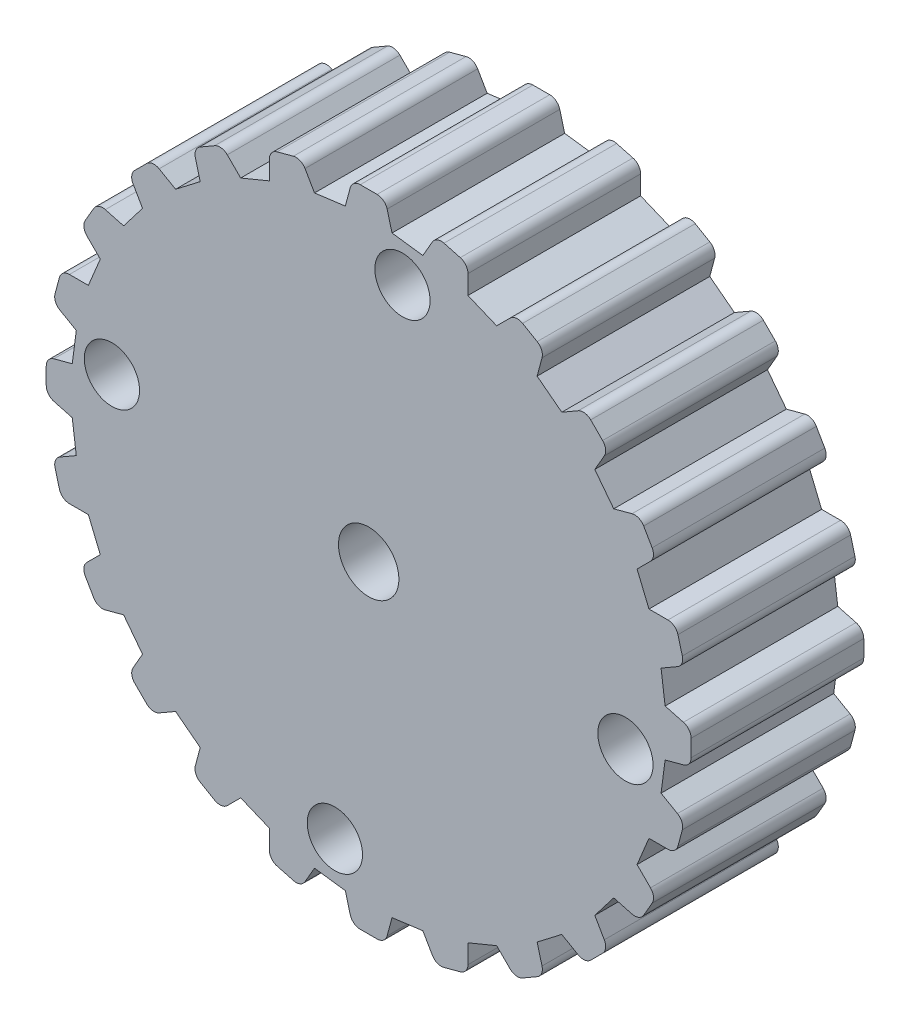
from build123d import *

# Parameters (mm, degrees)
BOSS_EXTRU_1_DEPTH      = 10
ESQUISSE2_R             = 1.6
ESQUISSE2_R_2           = 1.75
ENL_V_MAT_EXTRU_1_DEPTH = 29.241415019


with BuildPart() as part:
    # Esquisse1 → Boss.-Extru.1 (new body)
    with BuildSketch(Plane.XY):
        with BuildLine():
            Line((0.488939824, 18.675887158), (0, 18.675887158))
            Line((0, 18.675887158), (-0.488939824, 18.675887158))
            ThreePointArc((-0.488939824, 18.675887158), (-0.854196682, 18.551899162), (-1.06849532, 18.231178585))
            Line((-1.06849532, 18.231178585), (-1.352750131, 17.170325189))
            Line((-1.352750131, 17.170325189), (-3.137350881, 16.935378043))
            Line((-3.137350881, 16.935378043), (-3.686489007, 17.886513177))
            ThreePointArc((-3.686489007, 17.886513177), (-3.97649419, 18.140840897), (-4.361395677, 18.166068673))
            Line((-4.361395677, 18.166068673), (-4.833675281, 18.039521734))
            Line((-4.833675281, 18.039521734), (-5.305954884, 17.912974796))
            ThreePointArc((-5.305954884, 17.912974796), (-5.626675462, 17.698676158), (-5.750663457, 17.3334193))
            Line((-5.750663457, 17.3334193), (-5.750663457, 16.235143048))
            Line((-5.750663457, 16.235143048), (-7.413646616, 15.54631287))
            Line((-7.413646616, 15.54631287), (-8.190245201, 16.322911455))
            ThreePointArc((-8.190245201, 16.322911455), (-8.536193555, 16.493514304), (-8.91450927, 16.418262629))
            Line((-8.91450927, 16.418262629), (-9.337943579, 16.173792717))
            Line((-9.337943579, 16.173792717), (-9.761377888, 15.929322805))
            ThreePointArc((-9.761377888, 15.929322805), (-10.015705607, 15.639317622), (-10.040933383, 15.254416135))
            Line((-10.040933383, 15.254416135), (-9.756678573, 14.193562739))
            Line((-9.756678573, 14.193562739), (-11.184714585, 13.097792167))
            Line((-11.184714585, 13.097792167), (-12.13584972, 13.646930293))
            ThreePointArc((-12.13584972, 13.646930293), (-12.514165435, 13.722181967), (-12.860113788, 13.551579119))
            Line((-12.860113788, 13.551579119), (-13.205846454, 13.205846454))
            Line((-13.205846454, 13.205846454), (-13.551579119, 12.860113788))
            ThreePointArc((-13.551579119, 12.860113788), (-13.722181967, 12.514165435), (-13.646930293, 12.13584972))
            Line((-13.646930293, 12.13584972), (-13.097792167, 11.184714585))
            Line((-13.097792167, 11.184714585), (-14.193562739, 9.756678573))
            Line((-14.193562739, 9.756678573), (-15.254416135, 10.040933383))
            ThreePointArc((-15.254416135, 10.040933383), (-15.639317622, 10.015705607), (-15.929322805, 9.761377888))
            Line((-15.929322805, 9.761377888), (-16.173792717, 9.337943579))
            Line((-16.173792717, 9.337943579), (-16.418262629, 8.91450927))
            ThreePointArc((-16.418262629, 8.91450927), (-16.493514304, 8.536193555), (-16.322911455, 8.190245201))
            Line((-16.322911455, 8.190245201), (-15.54631287, 7.413646616))
            Line((-15.54631287, 7.413646616), (-16.235143048, 5.750663457))
            Line((-16.235143048, 5.750663457), (-17.3334193, 5.750663457))
            ThreePointArc((-17.3334193, 5.750663457), (-17.698676158, 5.626675462), (-17.912974796, 5.305954884))
            Line((-17.912974796, 5.305954884), (-18.039521734, 4.833675281))
            Line((-18.039521734, 4.833675281), (-18.166068673, 4.361395677))
            ThreePointArc((-18.166068673, 4.361395677), (-18.140840897, 3.97649419), (-17.886513177, 3.686489007))
            Line((-17.886513177, 3.686489007), (-16.935378043, 3.137350881))
            Line((-16.935378043, 3.137350881), (-17.170325189, 1.352750131))
            Line((-17.170325189, 1.352750131), (-18.231178585, 1.06849532))
            ThreePointArc((-18.231178585, 1.06849532), (-18.551899162, 0.854196682), (-18.675887158, 0.488939824))
            Line((-18.675887158, 0.488939824), (-18.675887158, 0))
            Line((-18.675887158, 0), (-18.675887158, -0.488939824))
            ThreePointArc((-18.675887158, -0.488939824), (-18.551899162, -0.854196682), (-18.231178585, -1.06849532))
            Line((-18.231178585, -1.06849532), (-17.170325189, -1.352750131))
            Line((-17.170325189, -1.352750131), (-16.935378043, -3.137350881))
            Line((-16.935378043, -3.137350881), (-17.886513177, -3.686489007))
            ThreePointArc((-17.886513177, -3.686489007), (-18.140840897, -3.97649419), (-18.166068673, -4.361395677))
            Line((-18.166068673, -4.361395677), (-18.039521734, -4.833675281))
            Line((-18.039521734, -4.833675281), (-17.912974796, -5.305954884))
            ThreePointArc((-17.912974796, -5.305954884), (-17.698676158, -5.626675462), (-17.3334193, -5.750663457))
            Line((-17.3334193, -5.750663457), (-16.235143048, -5.750663457))
            Line((-16.235143048, -5.750663457), (-15.54631287, -7.413646616))
            Line((-15.54631287, -7.413646616), (-16.322911455, -8.190245201))
            ThreePointArc((-16.322911455, -8.190245201), (-16.493514304, -8.536193555), (-16.418262629, -8.91450927))
            Line((-16.418262629, -8.91450927), (-16.173792717, -9.337943579))
            Line((-16.173792717, -9.337943579), (-15.929322805, -9.761377888))
            ThreePointArc((-15.929322805, -9.761377888), (-15.639317622, -10.015705607), (-15.254416135, -10.040933383))
            Line((-15.254416135, -10.040933383), (-14.193562739, -9.756678573))
            Line((-14.193562739, -9.756678573), (-13.097792167, -11.184714585))
            Line((-13.097792167, -11.184714585), (-13.646930293, -12.13584972))
            ThreePointArc((-13.646930293, -12.13584972), (-13.722181967, -12.514165435), (-13.551579119, -12.860113788))
            Line((-13.551579119, -12.860113788), (-13.205846454, -13.205846454))
            Line((-13.205846454, -13.205846454), (-12.860113788, -13.551579119))
            ThreePointArc((-12.860113788, -13.551579119), (-12.514165435, -13.722181967), (-12.13584972, -13.646930293))
            Line((-12.13584972, -13.646930293), (-11.184714585, -13.097792167))
            Line((-11.184714585, -13.097792167), (-9.756678573, -14.193562739))
            Line((-9.756678573, -14.193562739), (-10.040933383, -15.254416135))
            ThreePointArc((-10.040933383, -15.254416135), (-10.015705607, -15.639317622), (-9.761377888, -15.929322805))
            Line((-9.761377888, -15.929322805), (-9.337943579, -16.173792717))
            Line((-9.337943579, -16.173792717), (-8.91450927, -16.418262629))
            ThreePointArc((-8.91450927, -16.418262629), (-8.536193555, -16.493514304), (-8.190245201, -16.322911455))
            Line((-8.190245201, -16.322911455), (-7.413646616, -15.54631287))
            Line((-7.413646616, -15.54631287), (-5.750663457, -16.235143048))
            Line((-5.750663457, -16.235143048), (-5.750663457, -17.3334193))
            ThreePointArc((-5.750663457, -17.3334193), (-5.626675462, -17.698676158), (-5.305954884, -17.912974796))
            Line((-5.305954884, -17.912974796), (-4.833675281, -18.039521734))
            Line((-4.833675281, -18.039521734), (-4.361395677, -18.166068673))
            ThreePointArc((-4.361395677, -18.166068673), (-3.97649419, -18.140840897), (-3.686489007, -17.886513177))
            Line((-3.686489007, -17.886513177), (-3.137350881, -16.935378043))
            Line((-3.137350881, -16.935378043), (-1.352750131, -17.170325189))
            Line((-1.352750131, -17.170325189), (-1.06849532, -18.231178585))
            ThreePointArc((-1.06849532, -18.231178585), (-0.854196682, -18.551899162), (-0.488939824, -18.675887158))
            Line((-0.488939824, -18.675887158), (0, -18.675887158))
            Line((0, -18.675887158), (0.488939824, -18.675887158))
            ThreePointArc((0.488939824, -18.675887158), (0.854196682, -18.551899162), (1.06849532, -18.231178585))
            Line((1.06849532, -18.231178585), (1.352750131, -17.170325189))
            Line((1.352750131, -17.170325189), (3.137350881, -16.935378043))
            Line((3.137350881, -16.935378043), (3.686489007, -17.886513177))
            ThreePointArc((3.686489007, -17.886513177), (3.97649419, -18.140840897), (4.361395677, -18.166068673))
            Line((4.361395677, -18.166068673), (4.833675281, -18.039521734))
            Line((4.833675281, -18.039521734), (5.305954884, -17.912974796))
            ThreePointArc((5.305954884, -17.912974796), (5.626675462, -17.698676158), (5.750663457, -17.3334193))
            Line((5.750663457, -17.3334193), (5.750663457, -16.235143048))
            Line((5.750663457, -16.235143048), (7.413646616, -15.54631287))
            Line((7.413646616, -15.54631287), (8.190245201, -16.322911455))
            ThreePointArc((8.190245201, -16.322911455), (8.536193555, -16.493514304), (8.91450927, -16.418262629))
            Line((8.91450927, -16.418262629), (9.337943579, -16.173792717))
            Line((9.337943579, -16.173792717), (9.761377888, -15.929322805))
            ThreePointArc((9.761377888, -15.929322805), (10.015705607, -15.639317622), (10.040933383, -15.254416135))
            Line((10.040933383, -15.254416135), (9.756678573, -14.193562739))
            Line((9.756678573, -14.193562739), (11.184714585, -13.097792167))
            Line((11.184714585, -13.097792167), (12.13584972, -13.646930293))
            ThreePointArc((12.13584972, -13.646930293), (12.514165435, -13.722181967), (12.860113788, -13.551579119))
            Line((12.860113788, -13.551579119), (13.205846454, -13.205846454))
            Line((13.205846454, -13.205846454), (13.551579119, -12.860113788))
            ThreePointArc((13.551579119, -12.860113788), (13.722181967, -12.514165435), (13.646930293, -12.13584972))
            Line((13.646930293, -12.13584972), (13.097792167, -11.184714585))
            Line((13.097792167, -11.184714585), (14.193562739, -9.756678573))
            Line((14.193562739, -9.756678573), (15.254416135, -10.040933383))
            ThreePointArc((15.254416135, -10.040933383), (15.639317622, -10.015705607), (15.929322805, -9.761377888))
            Line((15.929322805, -9.761377888), (16.173792717, -9.337943579))
            Line((16.173792717, -9.337943579), (16.418262629, -8.91450927))
            ThreePointArc((16.418262629, -8.91450927), (16.493514304, -8.536193555), (16.322911455, -8.190245201))
            Line((16.322911455, -8.190245201), (15.54631287, -7.413646616))
            Line((15.54631287, -7.413646616), (16.235143048, -5.750663457))
            Line((16.235143048, -5.750663457), (17.3334193, -5.750663457))
            ThreePointArc((17.3334193, -5.750663457), (17.698676158, -5.626675462), (17.912974796, -5.305954884))
            Line((17.912974796, -5.305954884), (18.039521734, -4.833675281))
            Line((18.039521734, -4.833675281), (18.166068673, -4.361395677))
            ThreePointArc((18.166068673, -4.361395677), (18.140840897, -3.97649419), (17.886513177, -3.686489007))
            Line((17.886513177, -3.686489007), (16.935378043, -3.137350881))
            Line((16.935378043, -3.137350881), (17.170325189, -1.352750131))
            Line((17.170325189, -1.352750131), (18.231178585, -1.06849532))
            ThreePointArc((18.231178585, -1.06849532), (18.551899162, -0.854196682), (18.675887158, -0.488939824))
            Line((18.675887158, -0.488939824), (18.675887158, 0))
            Line((18.675887158, 0), (18.675887158, 0.488939824))
            ThreePointArc((18.675887158, 0.488939824), (18.551899162, 0.854196682), (18.231178585, 1.06849532))
            Line((18.231178585, 1.06849532), (17.170325189, 1.352750131))
            Line((17.170325189, 1.352750131), (16.935378043, 3.137350881))
            Line((16.935378043, 3.137350881), (17.886513177, 3.686489007))
            ThreePointArc((17.886513177, 3.686489007), (18.140840897, 3.97649419), (18.166068673, 4.361395677))
            Line((18.166068673, 4.361395677), (18.039521734, 4.833675281))
            Line((18.039521734, 4.833675281), (17.912974796, 5.305954884))
            ThreePointArc((17.912974796, 5.305954884), (17.698676158, 5.626675462), (17.3334193, 5.750663457))
            Line((17.3334193, 5.750663457), (16.235143048, 5.750663457))
            Line((16.235143048, 5.750663457), (15.54631287, 7.413646616))
            Line((15.54631287, 7.413646616), (16.322911455, 8.190245201))
            ThreePointArc((16.322911455, 8.190245201), (16.493514304, 8.536193555), (16.418262629, 8.91450927))
            Line((16.418262629, 8.91450927), (16.173792717, 9.337943579))
            Line((16.173792717, 9.337943579), (15.929322805, 9.761377888))
            ThreePointArc((15.929322805, 9.761377888), (15.639317622, 10.015705607), (15.254416135, 10.040933383))
            Line((15.254416135, 10.040933383), (14.193562739, 9.756678573))
            Line((14.193562739, 9.756678573), (13.097792167, 11.184714585))
            Line((13.097792167, 11.184714585), (13.646930293, 12.13584972))
            ThreePointArc((13.646930293, 12.13584972), (13.722181967, 12.514165435), (13.551579119, 12.860113788))
            Line((13.551579119, 12.860113788), (13.205846454, 13.205846454))
            Line((13.205846454, 13.205846454), (12.860113788, 13.551579119))
            ThreePointArc((12.860113788, 13.551579119), (12.514165435, 13.722181967), (12.13584972, 13.646930293))
            Line((12.13584972, 13.646930293), (11.184714585, 13.097792167))
            Line((11.184714585, 13.097792167), (9.756678573, 14.193562739))
            Line((9.756678573, 14.193562739), (10.040933383, 15.254416135))
            ThreePointArc((10.040933383, 15.254416135), (10.015705607, 15.639317622), (9.761377888, 15.929322805))
            Line((9.761377888, 15.929322805), (9.337943579, 16.173792717))
            Line((9.337943579, 16.173792717), (8.91450927, 16.418262629))
            ThreePointArc((8.91450927, 16.418262629), (8.536193555, 16.493514304), (8.190245201, 16.322911455))
            Line((8.190245201, 16.322911455), (7.413646616, 15.54631287))
            Line((7.413646616, 15.54631287), (5.750663457, 16.235143048))
            Line((5.750663457, 16.235143048), (5.750663457, 17.3334193))
            ThreePointArc((5.750663457, 17.3334193), (5.626675462, 17.698676158), (5.305954884, 17.912974796))
            Line((5.305954884, 17.912974796), (4.833675281, 18.039521734))
            Line((4.833675281, 18.039521734), (4.361395677, 18.166068673))
            ThreePointArc((4.361395677, 18.166068673), (3.97649419, 18.140840897), (3.686489007, 17.886513177))
            Line((3.686489007, 17.886513177), (3.137350881, 16.935378043))
            Line((3.137350881, 16.935378043), (1.352750131, 17.170325189))
            Line((1.352750131, 17.170325189), (1.06849532, 18.231178585))
            ThreePointArc((1.06849532, 18.231178585), (0.854196682, 18.551899162), (0.488939824, 18.675887158))
        make_face()
    extrude(amount=BOSS_EXTRU_1_DEPTH)

    # Esquisse2 → Enlèv. mat.-Extru.1 (cut, through all)
    with BuildSketch(Plane.XY.offset(10)):
        with Locations((14.871672921, -1.957892883)):
            Circle(ESQUISSE2_R)
        Circle(ESQUISSE2_R_2)
        with Locations((1.957892883, 14.871672921)):
            Circle(ESQUISSE2_R)
        with Locations((-1.957892883, -14.871672921)):
            Circle(ESQUISSE2_R)
        with Locations((-14.871672921, 1.957892883)):
            Circle(ESQUISSE2_R)
    extrude(amount=-ENL_V_MAT_EXTRU_1_DEPTH, mode=Mode.SUBTRACT)


solid = part.part
